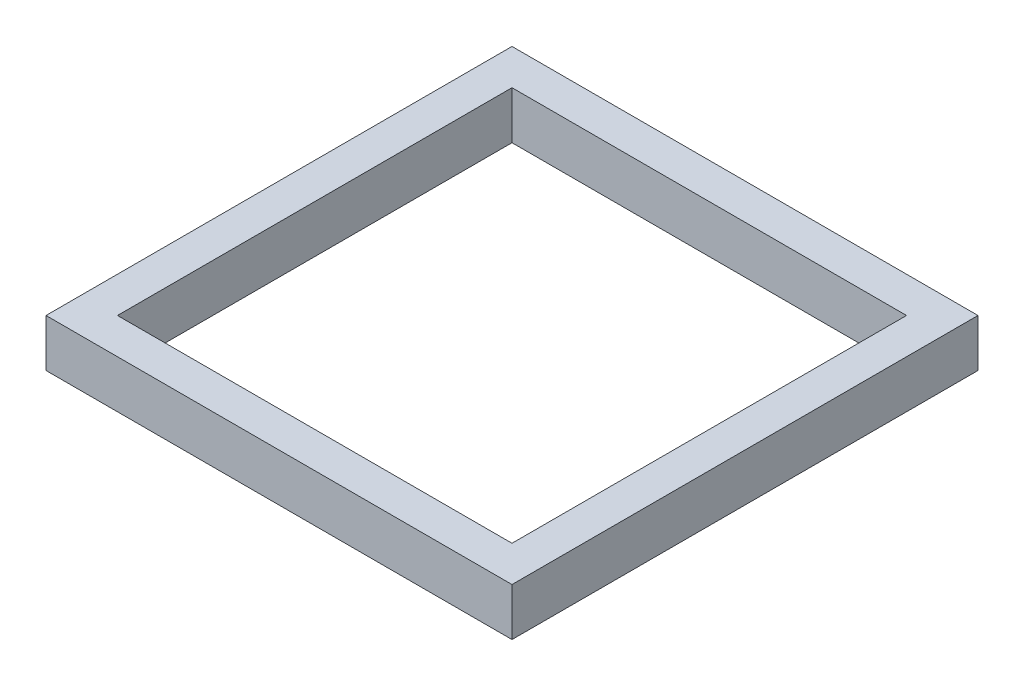
from build123d import *

# Parameters (mm, degrees)
SKETCH1_W           = 195.51
SKETCH1_H           = 195.51
SKETCH1_W_2         = 165.52
SKETCH1_H_2         = 165.52
BOSS_EXTRUDE1_DEPTH = 20


with BuildPart() as part:
    # Sketch1 → Boss-Extrude1 (new body)
    with BuildSketch(Plane(origin=(0, 0, 0), x_dir=(1, 0, 0), z_dir=(0, 1, 0))):
        Rectangle(SKETCH1_W, SKETCH1_H)
        Rectangle(SKETCH1_W_2, SKETCH1_H_2, mode=Mode.SUBTRACT)
    extrude(amount=BOSS_EXTRUDE1_DEPTH)


solid = part.part
